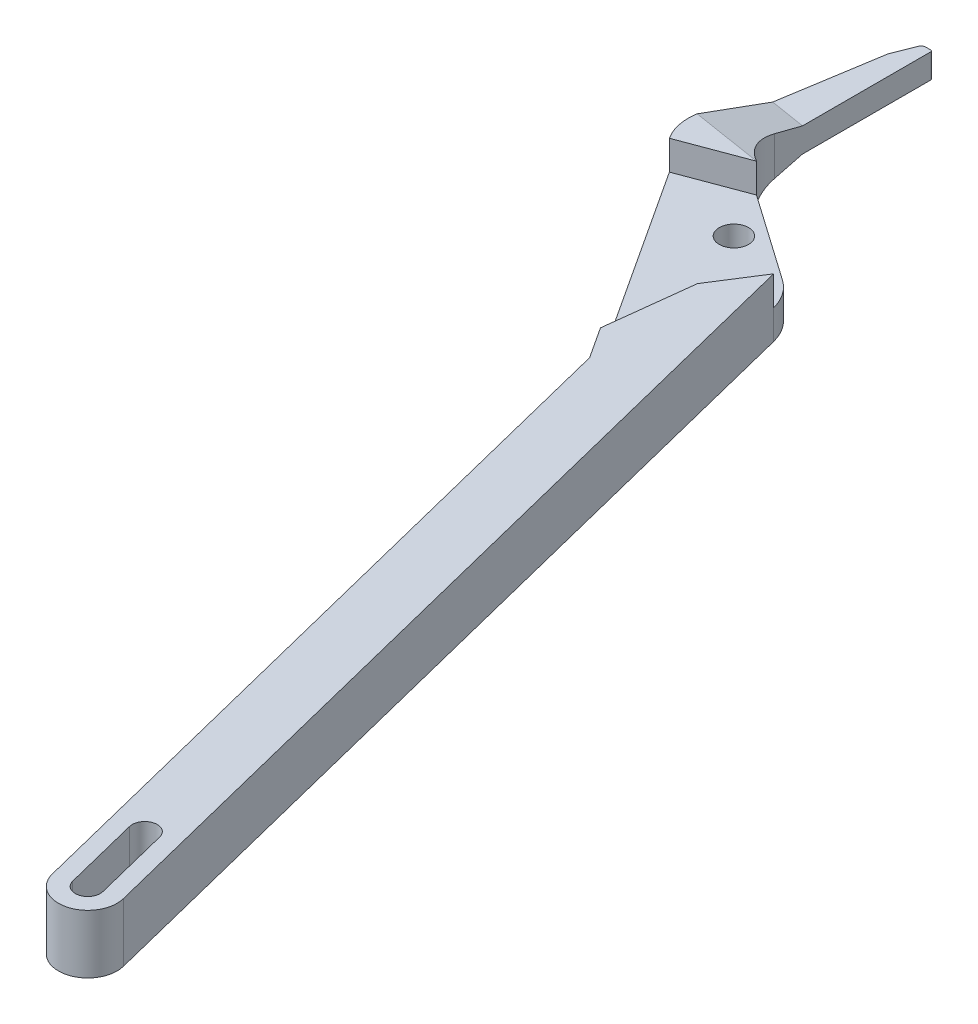
from build123d import *

# Parameters (mm, degrees)
SKETCH1_R           = 3
BOSS_EXTRUDE2_DEPTH = 12
SKETCH3_W           = 14.680148962
SKETCH3_H           = 3.5
CUT_EXTRUDE1_DEPTH  = 214.215717845
CUT_EXTRUDE4_DEPTH  = 6


with BuildPart() as part:
    # Sketch1 → Boss-Extrude2 (new body)
    with BuildSketch(Plane(origin=(0, 0, 0), x_dir=(1, 0, 0), z_dir=(0, 1, 0))):
        with BuildLine():
            ThreePointArc((49.32216584, -188.806160656), (56.59547157, -193.17640364), (60.965714553, -185.903097909))
            Line((60.965714554, -185.903097909), (16.76676248, -8.63078365))
            ThreePointArc((16.76676248, -8.63078365), (15.305067103, -5.385940236), (12.79956958, -2.858482163))
            Line((12.79956958, -2.858482163), (-5.735764363, 10.120098388))
            ThreePointArc((-5.735764363, 10.120098388), (-8.870108332, 13.694132698), (-10, 18.311618831))
            Line((-10, 18.311618831), (-10, 50.355948326))
            ThreePointArc((-10, 50.355948326), (-10.073223305, 50.532725021), (-10.25, 50.605948326))
            Line((-10.25, 50.605948326), (-11.322967039, 50.605948326))
            ThreePointArc((-11.322967039, 50.605948326), (-11.883595848, 50.434015556), (-12.251443729, 49.977339002))
            Line((-12.251443729, 49.977339002), (-13.876153382, 45.915564871))
            ThreePointArc((-13.876153382, 45.915564871), (-13.982191925, 45.601023533), (-14.052832331, 45.276692901))
            Line((-14.052832331, 45.276692901), (-19.445744306, 11.667622342))
            ThreePointArc((-19.445744306, 11.667622342), (-19.325125521, 8.055028023), (-17.928078586, 4.721314409))
            Line((-17.928078586, 4.721314409), (12.801336755, -42.329115693))
            Line((12.801336755, -42.329115693), (49.322165839, -188.806160656))
        make_face()
        with BuildLine():
            Line((53.747443969, -171.212996829), (57.618194299, -186.737728449))
            ThreePointArc((57.618194299, -186.737728449), (55.76084103, -189.828883385), (52.669686095, -187.971530117))
            Line((52.669686095, -187.971530117), (48.798935765, -172.446798496))
            ThreePointArc((48.798935765, -172.446798496), (50.656289033, -169.355643561), (53.747443969, -171.212996829))
        make_face(mode=Mode.SUBTRACT)
        with Locations(Location((0, 0, 0), (0, 0, 270))):
            Circle(SKETCH1_R, mode=Mode.SUBTRACT)
    extrude(amount=BOSS_EXTRUDE2_DEPTH)

    # Sketch3 → Cut-Extrude1 (cut, through all)
    with BuildSketch(Plane(origin=(-20.818600927, 0, -3.11186707), x_dir=(-0.15843335293481708, 0, 0.9873696737685596), z_dir=(-0.9873696737685597, 0, -0.1584333529348171))):
        Polygon((-42.704193729, 0), (-8.890997144, 0), (-22.384342691, 3.5), (-42.704193729, 3.5), align=None)
        Polygon((-22.384342691, 8.5), (-8.890997144, 12), (-42.704193729, 12), (-42.704193729, 8.5), align=None)
        with Locations((-50.04426821, 10.25)):
            Rectangle(SKETCH3_W, SKETCH3_H)
        with Locations((-50.04426821, 1.75)):
            Rectangle(SKETCH3_W, SKETCH3_H)
    extrude(amount=-CUT_EXTRUDE1_DEPTH, mode=Mode.SUBTRACT)

    # Sketch4 → Cut-Extrude4 (cut)
    with BuildSketch(Plane(origin=(0, 12, 0), x_dir=(1, 0, 0), z_dir=(0, 1, 0))):
        Polygon((-4.95077941, 9.570446006), (-17.928078586, 4.721314409), (8.620757021, -35.928145405), (10.712205441, -18.154940656), (16.76676248, -8.63078365), (17.432158169, -2.976226879), align=None)
    extrude(amount=-CUT_EXTRUDE4_DEPTH, mode=Mode.SUBTRACT)


solid = part.part
